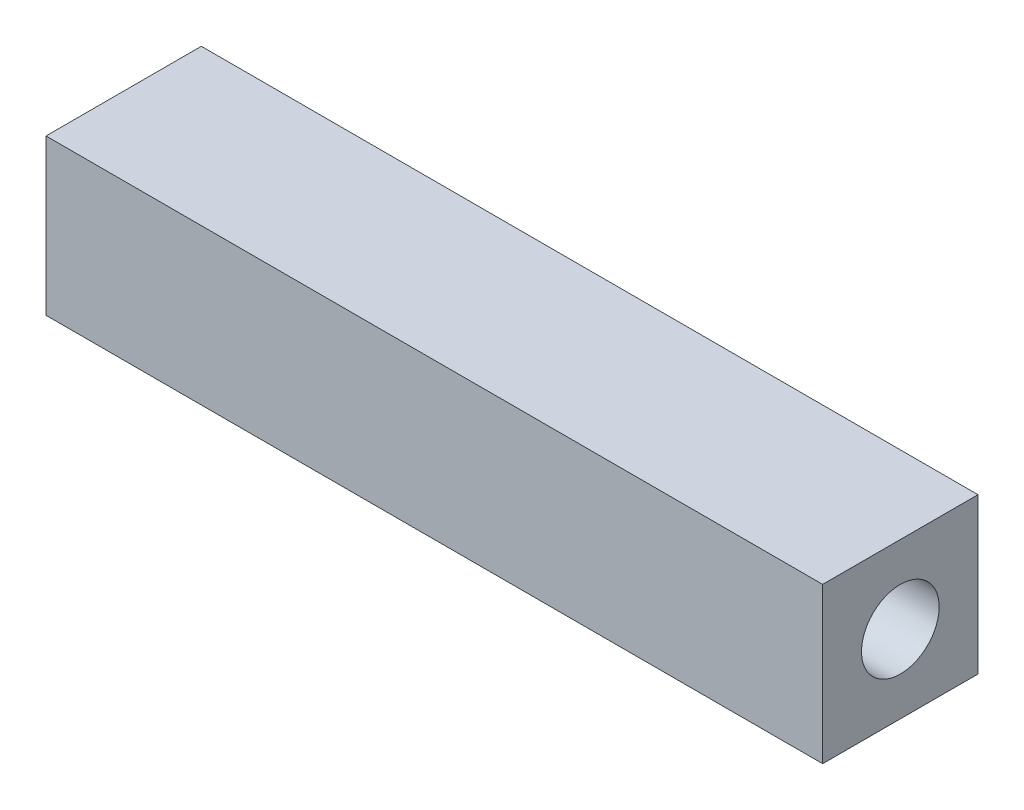
from build123d import *

# Parameters (mm, degrees)
CROQUIS1_W              = 20
CROQUIS1_H              = 20
CROQUIS1_R              = 5
SALIENTE_EXTRUIR1_DEPTH = 100


with BuildPart() as part:
    # Croquis1 → Saliente-Extruir1 (new body)
    with BuildSketch(Plane(origin=(0, 0, 0), x_dir=(0, 0, -1), z_dir=(1, 0, 0))):
        with Locations((10, 10)):
            Rectangle(CROQUIS1_W, CROQUIS1_H)
        with Locations((10, 10)):
            Circle(CROQUIS1_R, mode=Mode.SUBTRACT)
    extrude(amount=SALIENTE_EXTRUIR1_DEPTH)


solid = part.part
